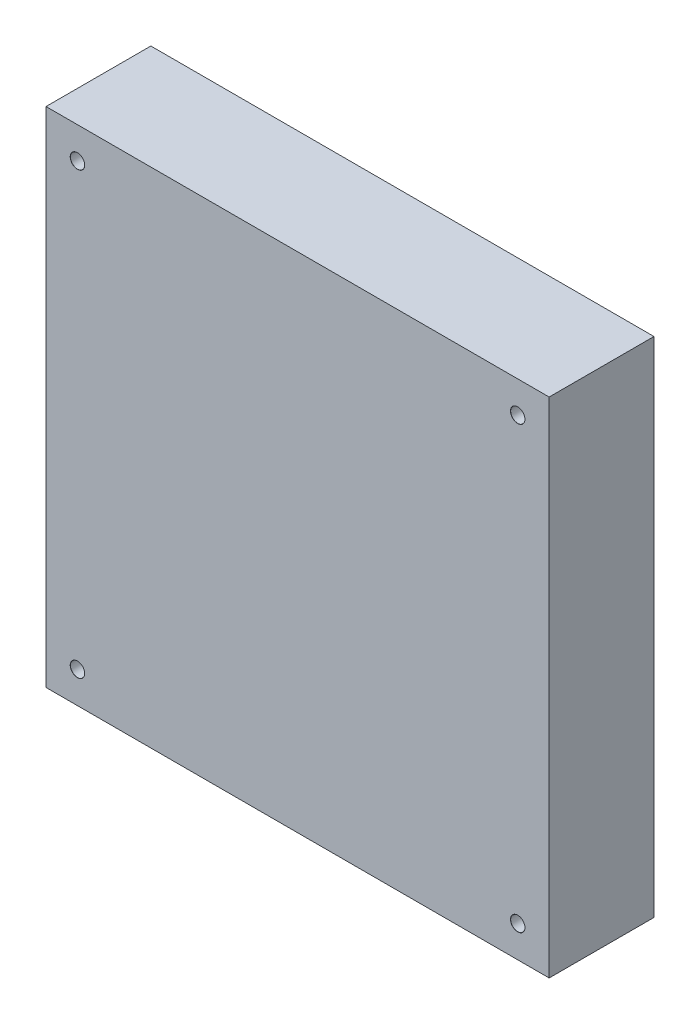
from build123d import *

# Parameters (mm, degrees)
SKETCH1_W                      = 120
SKETCH1_H                      = 120
BOSS_EXTRUDE1_DEPTH            = 25
M3_CLEARANCE_HOLE1_D           = 3.4
M3_CLEARANCE_HOLE1_CSINK_D     = 3.45
M3_CLEARANCE_HOLE1_CSINK_ANGLE = 100


with BuildPart() as part:
    # Sketch1 → Boss-Extrude1 (new body)
    with BuildSketch(Plane.XY):
        Rectangle(SKETCH1_W, SKETCH1_H)
    extrude(amount=BOSS_EXTRUDE1_DEPTH)

    # M3 Clearance Hole1 (through all)
    with Locations(Plane.XY.offset(25)):
        with Locations((-52.5, 52.5), (52.5, 52.5), (52.5, -52.5), (-52.5, -52.5)):
            CounterSinkHole(M3_CLEARANCE_HOLE1_D / 2, M3_CLEARANCE_HOLE1_CSINK_D / 2, counter_sink_angle=M3_CLEARANCE_HOLE1_CSINK_ANGLE)


solid = part.part
